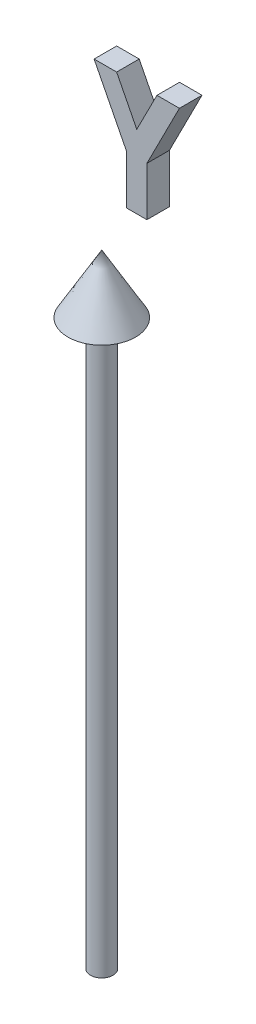
from build123d import *

# Parameters (mm, degrees)
SKETCH1_R           = 1
BOSS_EXTRUDE1_DEPTH = 50
BOSS_EXTRUDE2_DEPTH = 1


with BuildPart() as part:
    # Sketch1 → Boss-Extrude1 (new body)
    with BuildSketch(Plane(origin=(0, 0, 0), x_dir=(1, 0, 0), z_dir=(0, 1, 0))):
        with Locations(Location((0, 0, 0), (0, 0, 270))):
            Circle(SKETCH1_R)
    extrude(amount=BOSS_EXTRUDE1_DEPTH)

    # Sketch2 → Revolve1 (revolve)
    with BuildSketch(Plane.XY, mode=Mode.PRIVATE) as revolve1_sk:
        Polygon((0, 50), (-3, 50), (0, 55.196152423), align=None)
    revolve(revolve1_sk.sketch.rotate(Axis((0, 55.196152423, 0), (0, -1, 0)), 90), axis=Axis((0, 55.196152423, 0), (0, -1, 0)))


with BuildPart() as body_2:
    # Sketch3 → Boss-Extrude2 (new, symmetric)
    with BuildSketch(Plane.XY):
        Polygon((0.320512821, 70.515088714), (2.317708333, 70.515088714), (4.102564103, 67.00547333), (5.891426282, 70.515088714), (7.884615385, 70.515088714), (5, 64.846018202), (5, 60.515088714), (3.205128205, 60.515088714), (3.205128205, 64.846018202), align=None)
    extrude(amount=BOSS_EXTRUDE2_DEPTH, both=True)


solid = Compound([part.part, body_2.part])
